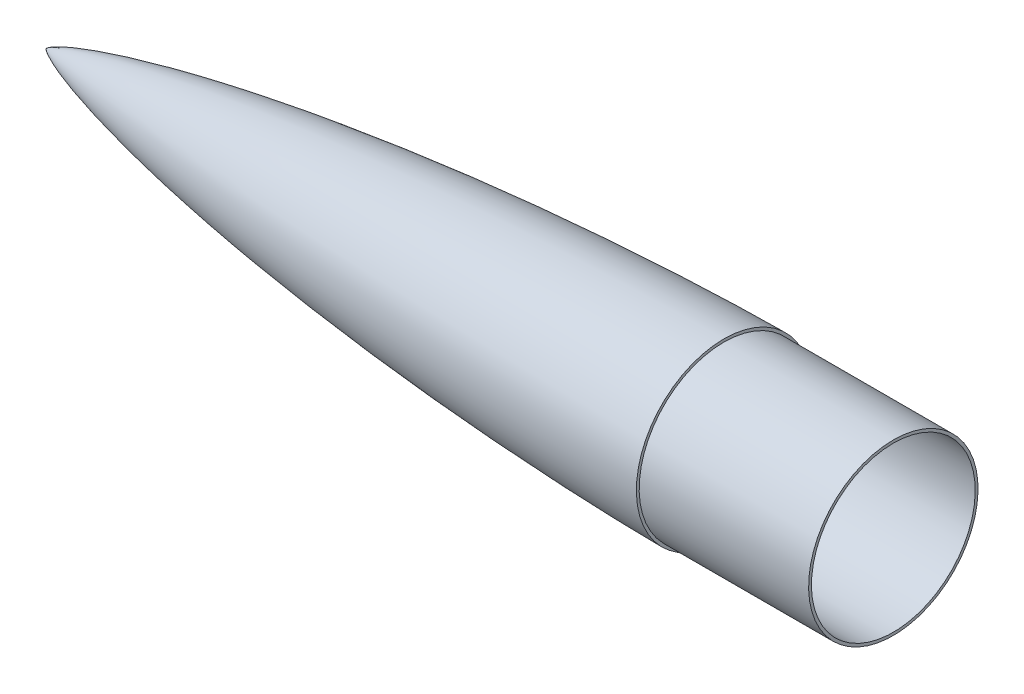
from build123d import *

# Parameters (mm, degrees)
ESQUISSE2_R        = 75
ESQUISSE2_R_2      = 72.5
BOSS_EXTRU_1_DEPTH = 150


with BuildPart() as part:
    # Esquisse1 → Révolution2 (revolve)
    with BuildSketch(Plane.XY):
        with BuildLine():
            Line((600, 77.47), (600, 0))
            Line((600, 0), (0, 0))
            add(Edge.make_bspline(
                [(0, 0), (0.001368209, 0.006717054), (0.004827879, 0.019916848), (0.014861135, 0.045329548), (0.040109462, 0.093838359), (0.080714574, 0.157043573), (0.138303004, 0.233353669), (0.220339344, 0.329970565), (0.319234099, 0.435072494), (0.434907239, 0.547862018), (0.567424397, 0.667916865), (0.77138124, 0.842123474), (1.105192587, 1.105167654), (1.695210245, 1.526031902), (2.747835687, 2.192934332), (4.58865834, 3.221966447), (7.854167938, 4.816978698), (13.522718171, 7.218567437), (23.083517428, 10.718170388), (38.736152508, 15.653589654), (62.100931146, 21.963904539), (92.158204371, 28.916284866), (127.237565622, 35.932970079), (164.730421006, 42.483131418), (202.346019248, 48.281341783), (240.055676064, 53.429010598), (277.839844478, 57.995158719), (315.684360025, 62.028879064), (353.578315333, 65.566601852), (391.513008679, 68.635634982), (429.481236678, 71.256357435), (467.476897077, 73.442933418), (500.742476414, 74.982720386), (529.266767626, 76.033942798), (552.966974815, 76.720644239), (569.49898194, 77.095642081), (583.616580802, 77.333227016), (592.97836336, 77.434381513), (597.659426856, 77.465844708), (600, 77.47)],
                knots=[0, 0, 0, 0, 0, 4.4888e-05, 8.9776e-05, 0.000179552, 0.000359104, 0.000538656, 0.000718209, 0.001013211, 0.001308213, 0.001601358, 0.001894502, 0.002777797, 0.004103551, 0.006367612, 0.010089263, 0.016646759, 0.028003564, 0.046855525, 0.077051893, 0.124598739, 0.187198888, 0.24979905, 0.31239921, 0.37499937, 0.437599529, 0.500199693, 0.562799853, 0.625400016, 0.688000177, 0.750600339, 0.813200502, 0.875800663, 0.907100744, 0.938400825, 0.969200412, 0.984600206, 1, 1, 1, 1, 1], degree=4))
        make_face()
    revolve(axis=Axis((2700, 0, 0), (-1, 0, 0)))

    # Esquisse2 → Boss.-Extru.1 (add)
    with BuildSketch(Plane(origin=(600, 0, 0), x_dir=(0, 0, -1), z_dir=(1, 0, 0))):
        with Locations(Location((0, 0, 0), (0, 0, 90))):
            Circle(ESQUISSE2_R)
        with Locations(Location((0, 0, 0), (0, 0, 90))):
            Circle(ESQUISSE2_R_2, mode=Mode.SUBTRACT)
    extrude(amount=BOSS_EXTRU_1_DEPTH)


solid = part.part
